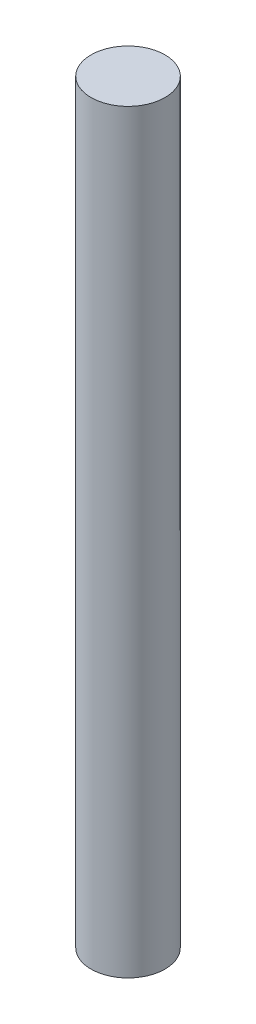
from build123d import *

# Parameters (mm, degrees)
SKETCH_1_R      = 1.75
EXTRUDE_1_DEPTH = 17.85


with BuildPart() as part:
    # 草图1 → 凸台-拉伸1 (new, symmetric)
    with BuildSketch(Plane(origin=(0, 0, 0), x_dir=(1, 0, 0), z_dir=(0, 1, 0))):
        with Locations(Location((0, 0, 0), (0, 0, 90))):
            Circle(SKETCH_1_R)
    extrude(amount=EXTRUDE_1_DEPTH, both=True)


solid = part.part
